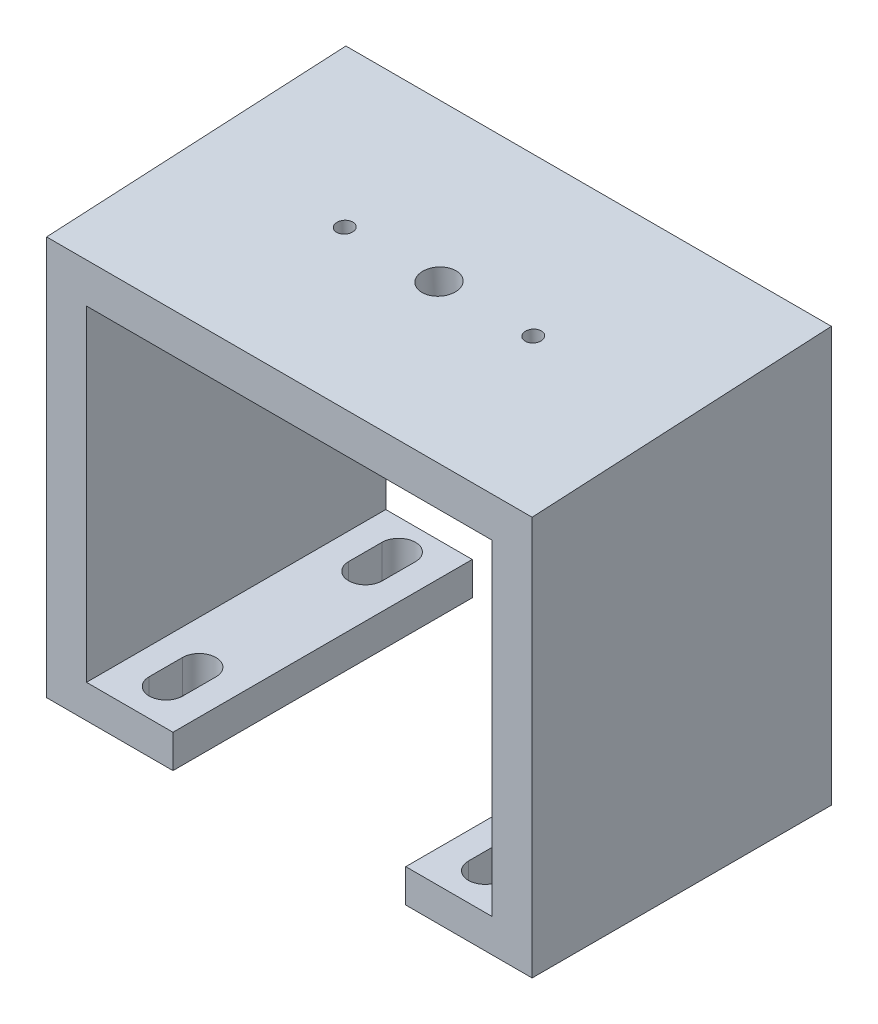
from build123d import *

# Parameters (mm, degrees)
BOSS_EXTRUDE1_DEPTH      = 57.15
CUT_EXTRUDE1_DEPTH       = 102.459011551
BOSS_EXTRUDE2_DEPTH      = 92.71
F_0_257_DIAMETER_HOLE1_D = 6.5278
F_3_0MM_DOWEL_HOLE1_D    = 3.1


with BuildPart() as part:
    # Sketch2 → Boss-Extrude1 (new body)
    with BuildSketch(Plane.XY):
        Polygon((-46.355, 0), (46.355, 0), (46.355, -76.2), (22.225, -76.2), (22.225, -69.85), (38.735, -69.85), (38.735, -7.62), (-38.735, -7.62), (-38.735, -69.85), (-22.225, -69.85), (-22.225, -76.2), (-46.355, -76.2), align=None)
    extrude(amount=BOSS_EXTRUDE1_DEPTH)

    # Sketch3 → Cut-Extrude1 (cut, through all)
    with BuildSketch(Plane(origin=(0, -69.85, 0), x_dir=(1, 0, 0), z_dir=(0, 1, 0))):
        with BuildLine():
            Line((-27.27706, -5.784822778), (-27.27706, -12.134822778))
            ThreePointArc((-27.27706, -12.134822778), (-30.48, -15.337762778), (-33.68294, -12.134822778))
            Line((-33.68294, -12.134822778), (-33.68294, -5.784822778))
            ThreePointArc((-33.68294, -5.784822778), (-30.48, -2.581882778), (-27.27706, -5.784822778))
        make_face()
        with BuildLine():
            Line((-33.68294, -50.234822778), (-33.68294, -43.884822778))
            ThreePointArc((-33.68294, -43.884822778), (-30.48, -40.681882778), (-27.27706, -43.884822778))
            Line((-27.27706, -43.884822778), (-27.27706, -50.234822778))
            ThreePointArc((-27.27706, -50.234822778), (-30.48, -53.437762778), (-33.68294, -50.234822778))
        make_face()
    cut_extrude1 = extrude(amount=-CUT_EXTRUDE1_DEPTH, mode=Mode.SUBTRACT)

    # Mirror1: Cut-Extrude1 across plane
    add(cut_extrude1.mirror(Plane(origin=(0, 0, 0), x_dir=(0, 0, 1), z_dir=(1, 0, 0))), mode=Mode.SUBTRACT)

    # Sketch4 → Boss-Extrude2 (add)
    with BuildSketch(Plane.ZY.offset(46.355)):
        Polygon((57.15, 0), (0, 0), (0, 2.995104586), align=None)
    extrude(amount=-BOSS_EXTRUDE2_DEPTH)

    # F (0.257) Diameter Hole1 (through all)
    with Locations(Plane(origin=(0, 2.986900838, 0.15653684), x_dir=(1, 0, 0), z_dir=(0, 0.9986295347545744, 0.052335956242936806))):
        with Locations((0, -28.457463124)):
            Hole(F_0_257_DIAMETER_HOLE1_D / 2)

    # Ø3.0mm Dowel Hole1 (through all)
    with Locations(Plane(origin=(0, 2.986900838, 0.15653684), x_dir=(1, 0, 0), z_dir=(0, 0.9986295347545744, 0.052335956242936806))):
        with Locations((-18, -28.457463124), (18, -28.457463124)):
            Hole(F_3_0MM_DOWEL_HOLE1_D / 2)


solid = part.part
